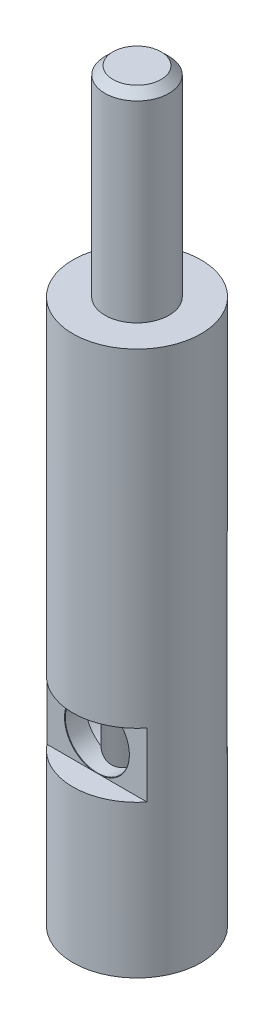
from build123d import *

# Parameters (mm, degrees)
SKETCH1_R                            = 4
BOSS_EXTRUDE1_DEPTH                  = 34
F_3_2_3_2_DIAMETER_HOLE3_D           = 3.2
F_3_2_3_2_DIAMETER_HOLE3_DEPTH       = 14
F_3_2_3_2_DIAMETER_HOLE3_CSINK_D     = 3.25
F_3_2_3_2_DIAMETER_HOLE3_CSINK_ANGLE = 90
F_3_2_3_2_DIAMETER_HOLE3_TIP         = 0.96137699
SKETCH4_W                            = 3
SKETCH4_H                            = 4
SKETCH4_H_2                          = 12
CUT_EXTRUDE1_DEPTH                   = 4
SKETCH8_R                            = 2
BOSS_EXTRUDE2_DEPTH                  = 12
SKETCH9_R                            = 2
BOSS_EXTRUDE3_DEPTH                  = 0.5
BOSS_EXTRUDE3_TAPER                  = 45


with BuildPart() as part:
    # Sketch1 → Boss-Extrude1 (new body)
    with BuildSketch(Plane(origin=(0, 0, 0), x_dir=(1, 0, 0), z_dir=(0, 1, 0))):
        with Locations(Location((0, 0, 0), (0, 0, 270))):
            Circle(SKETCH1_R)
    extrude(amount=BOSS_EXTRUDE1_DEPTH)

    # Ø3.2 (3.2) Diameter Hole3
    with Locations(Plane(origin=(0, 0, 0), x_dir=(-1, 0, 0), z_dir=(0, -1, 0))):
        with Locations((0, 0)):
            CounterSinkHole(F_3_2_3_2_DIAMETER_HOLE3_D / 2, F_3_2_3_2_DIAMETER_HOLE3_CSINK_D / 2, depth=F_3_2_3_2_DIAMETER_HOLE3_DEPTH, counter_sink_angle=F_3_2_3_2_DIAMETER_HOLE3_CSINK_ANGLE)
            with Locations((0, 0, -(F_3_2_3_2_DIAMETER_HOLE3_DEPTH + F_3_2_3_2_DIAMETER_HOLE3_TIP / 2))):  # 118° drill point
                Cone(0, F_3_2_3_2_DIAMETER_HOLE3_D / 2, F_3_2_3_2_DIAMETER_HOLE3_TIP, mode=Mode.SUBTRACT)

    # Sketch4 → Cut-Extrude1 (cut, symmetric)
    with BuildSketch(Plane(origin=(0, 0, 0), x_dir=(0, 0, -1), z_dir=(1, 0, 0))):
        with Locations((-4, 11.5)):
            Rectangle(SKETCH4_W, SKETCH4_H)
        with Locations((4, 15.5)):
            Rectangle(SKETCH4_W, SKETCH4_H_2)
    extrude(amount=CUT_EXTRUDE1_DEPTH, both=True, mode=Mode.SUBTRACT)

    # Sketch6 → Ø4.0 (4) Diameter Hole2 (revolve, cut)
    with BuildSketch(Plane(origin=(0, 11.5, 2.5), x_dir=(0, -1, 0), z_dir=(1, 0, 0))):
        Polygon((0, 0), (0, 2.5), (2, 1.298278762), (2, 0.025), (2.025, 0), align=None)
    revolve(axis=Axis((0, 11.5, 8.85), (0, 0, -1)), mode=Mode.SUBTRACT)

    # Sketch8 → Boss-Extrude2 (add)
    with BuildSketch(Plane(origin=(0, 34, 0), x_dir=(1, 0, 0), z_dir=(0, 1, 0))):
        with Locations(Location((0, 0, 0), (0, 0, 270))):
            Circle(SKETCH8_R)
    extrude(amount=BOSS_EXTRUDE2_DEPTH)

    # Sketch9 → Boss-Extrude3 (add)
    with BuildSketch(Plane(origin=(0, 46, 0), x_dir=(1, 0, 0), z_dir=(0, 1, 0))):
        with Locations(Location((0, 0, 0), (0, 0, 270))):
            Circle(SKETCH9_R)
    extrude(amount=BOSS_EXTRUDE3_DEPTH, taper=BOSS_EXTRUDE3_TAPER)


solid = part.part
